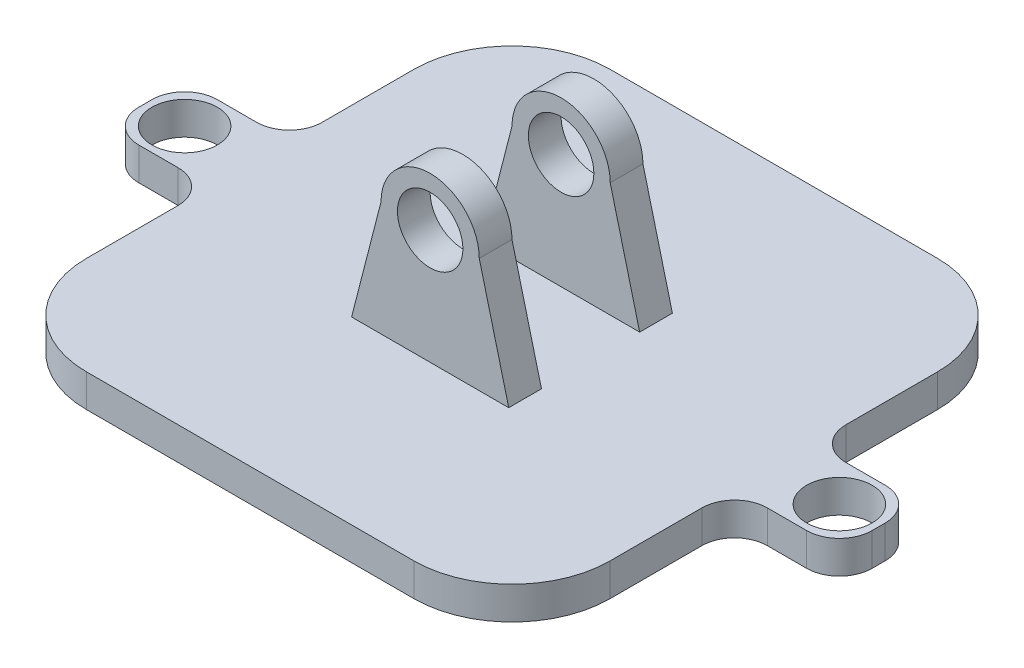
from build123d import *

# Parameters (mm, degrees)
SKETCH1_R           = 5
BOSS_EXTRUDE1_DEPTH = 2.5
FILLET1_R           = 5
BOSS_EXTRUDE2_START = 10
BOSS_EXTRUDE2_DEPTH = 2.5
BOSS_EXTRUDE3_START = -10
BOSS_EXTRUDE3_DEPTH = 2.5
SKETCH3_R           = 5
CUT_EXTRUDE1_DEPTH  = 85


with BuildPart() as part:
    # Sketch1 → Boss-Extrude1 (new, symmetric)
    with BuildSketch(Plane(origin=(0, 0, 0), x_dir=(1, 0, 0), z_dir=(0, 1, 0))):
        with BuildLine():
            Line((-40, 6), (-56, 6))
            Line((-56, 6), (-56, -6))
            Line((-56, -6), (-40, -6))
            Line((-40, -6), (-40, -25))
            ThreePointArc((-40, -25), (-35.606601718, -35.606601718), (-25, -40))
            Line((-25, -40), (25, -40))
            ThreePointArc((25, -40), (35.606601718, -35.606601718), (40, -25))
            Line((40, -25), (40, -6))
            Line((40, -6), (56, -6))
            Line((56, -6), (56, 6))
            Line((56, 6), (40, 6))
            Line((40, 6), (40, 25))
            ThreePointArc((40, 25), (35.606601718, 35.606601718), (25, 40))
            Line((25, 40), (-25, 40))
            ThreePointArc((-25, 40), (-35.606601718, 35.606601718), (-40, 25))
            Line((-40, 25), (-40, 6))
        make_face()
        with Locations((-50, 0)):
            Circle(SKETCH1_R, mode=Mode.SUBTRACT)
        with Locations((50, 0)):
            Circle(SKETCH1_R, mode=Mode.SUBTRACT)
    extrude(amount=BOSS_EXTRUDE1_DEPTH, both=True)

    # Fillet1
    fillet1_edges = [part.edges().sort_by_distance(p)[0] for p in [
        (-40, 0, -6),
        (-56, 0, -6),
        (-56, 0, 6),
        (-40, 0, 6),
        (40, 0, -6),
        (56, 0, -6),
        (56, 0, 6),
        (40, 0, 6),
    ]]
    fillet(fillet1_edges, radius=FILLET1_R)

    # Sketch2 → Boss-Extrude2 (add, symmetric)
    with BuildSketch(Plane.XY.offset(BOSS_EXTRUDE2_START)):
        with BuildLine():
            Line((-7.5, 20), (-12, 2.5))
            Line((-12, 2.5), (12, 2.5))
            Line((12, 2.5), (7.5, 20))
            ThreePointArc((7.5, 20), (0, 27.5), (-7.5, 20))
        make_face()
    extrude(amount=BOSS_EXTRUDE2_DEPTH, both=True)

    # Sketch2<2> → Boss-Extrude3 (add, symmetric)
    with BuildSketch(Plane.XY.offset(BOSS_EXTRUDE3_START)):
        with BuildLine():
            Line((-7.5, 20), (-12, 2.5))
            Line((-12, 2.5), (12, 2.5))
            Line((12, 2.5), (7.5, 20))
            ThreePointArc((7.5, 20), (0, 27.5), (-7.5, 20))
        make_face()
    extrude(amount=BOSS_EXTRUDE3_DEPTH, both=True)

    # Sketch3 → Cut-Extrude1 (cut)
    with BuildSketch(Plane.XY.offset(12.5)):
        with Locations((0, 20)):
            Circle(SKETCH3_R)
    extrude(amount=-CUT_EXTRUDE1_DEPTH, mode=Mode.SUBTRACT)


solid = part.part
